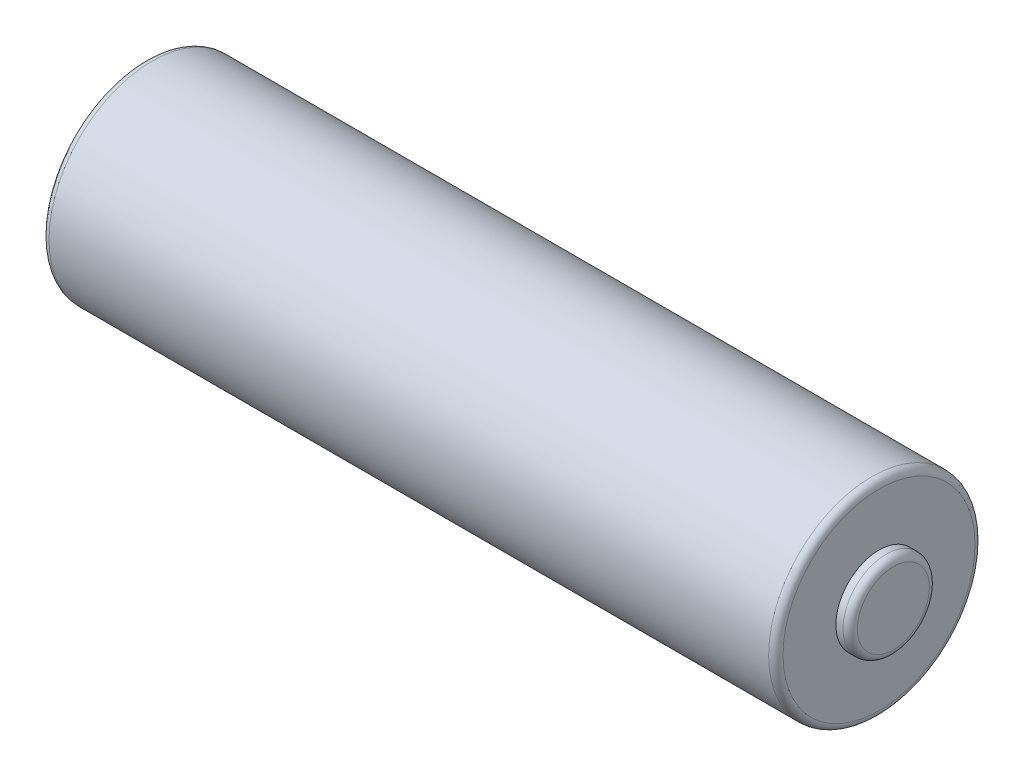
from build123d import *

# Parameters (mm, degrees)
SKETCH1_R           = 7.17
BOSS_EXTRUDE1_DEPTH = 25.5
SKETCH2_R           = 3
BOSS_EXTRUDE2_DEPTH = 1
FILLET1_R           = 0.5


with BuildPart() as part:
    # Sketch1 → Boss-Extrude1 (new, symmetric)
    with BuildSketch(Plane(origin=(0, 0, 0), x_dir=(0, 0, -1), z_dir=(1, 0, 0))):
        Circle(SKETCH1_R)
    extrude(amount=BOSS_EXTRUDE1_DEPTH, both=True)

    # Sketch2 → Boss-Extrude2 (add)
    with BuildSketch(Plane(origin=(25.5, 0, 0), x_dir=(0, 0, -1), z_dir=(1, 0, 0))):
        Circle(SKETCH2_R)
    extrude(amount=BOSS_EXTRUDE2_DEPTH)

    # Fillet1
    fillet1_edges = [part.edges().sort_by_distance(p)[0] for p in [
        (-25.5, 0, 7.17),
        (25.5, 0, 7.17),
        (26.5, 0, 3),
    ]]
    fillet(fillet1_edges, radius=FILLET1_R)


solid = part.part
